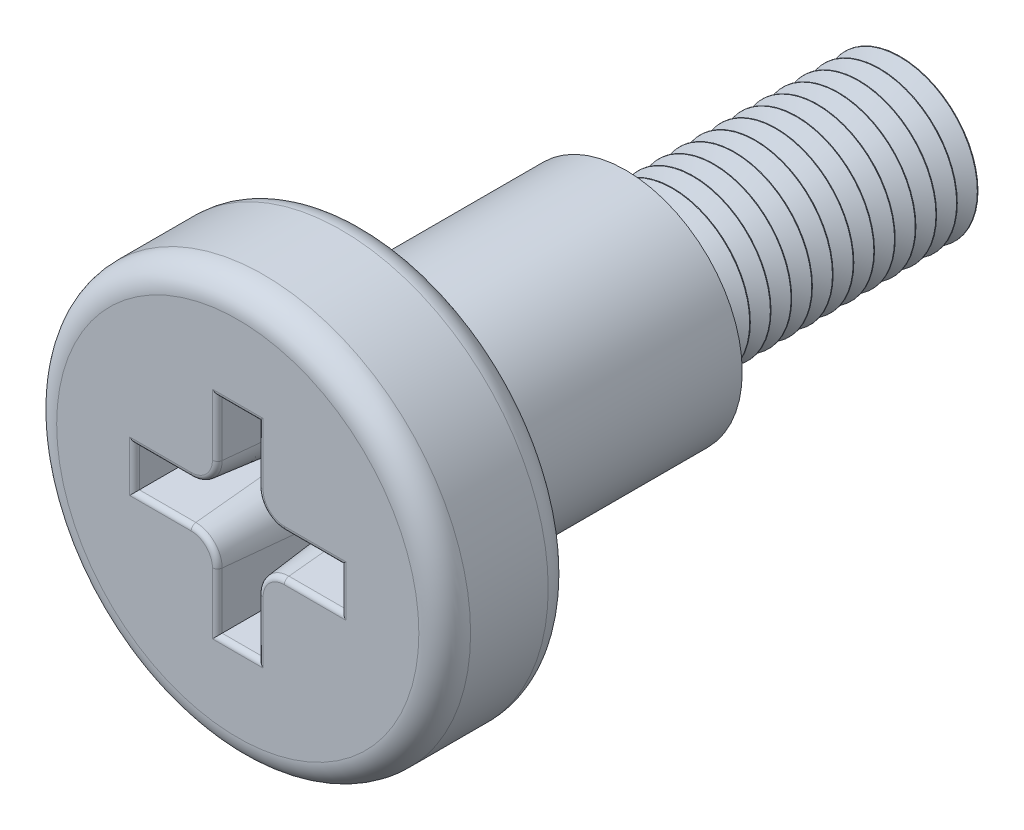
from build123d import *

# Parameters (mm, degrees)
SKETCH1_R           = 4
BOSS_EXTRUDE1_DEPTH = 2.5
FILLET1_R           = 0.5
SKETCH2_R           = 2.25
BOSS_EXTRUDE2_DEPTH = 5
SKETCH3_R           = 1.5
BOSS_EXTRUDE3_DEPTH = 5.5
CUT_EXTRUDE1_DEPTH  = 2
CUT_EXTRUDE1_DRAFT  = -6
FILLET2_R           = 0.1
LPATTERN1_COUNT     = 14
LPATTERN1_PITCH     = 0.4


with BuildPart() as part:
    # Sketch1 → Boss-Extrude1 (new body)
    with BuildSketch(Plane.XY):
        Circle(SKETCH1_R)
    extrude(amount=BOSS_EXTRUDE1_DEPTH)

    # Fillet1
    fillet1_edges = [part.edges().sort_by_distance(p)[0] for p in [
        (-4, 0, 0),
        (-4, 0, 2.5),
    ]]
    fillet(fillet1_edges, radius=FILLET1_R)

    # Sketch2 → Boss-Extrude2 (add)
    with BuildSketch(Plane(origin=(0, 0, 0), x_dir=(-1, 0, 0), z_dir=(0, 0, -1))):
        with Locations(Location((0, 0, 0), (0, 0, 180))):
            Circle(SKETCH2_R)
    extrude(amount=BOSS_EXTRUDE2_DEPTH)

    # Sketch3 → Boss-Extrude3 (add)
    with BuildSketch(Plane(origin=(0, 0, -5), x_dir=(-1, 0, 0), z_dir=(0, 0, -1))):
        Circle(SKETCH3_R)
    extrude(amount=BOSS_EXTRUDE3_DEPTH)


with BuildPart() as cut_extrude1_tool:
    # Sketch4 → Cut-Extrude1 (with draft: the straight prism first)
    with BuildSketch(Plane.XY.offset(2.5)):
        with BuildLine():
            Line((-0.4, -2), (0.4, -2))
            Line((0.4, -2), (0.4, -0.9))
            ThreePointArc((0.4, -0.9), (0.546446609, -0.546446609), (0.9, -0.4))
            Line((0.9, -0.4), (2, -0.4))
            Line((2, -0.4), (2, 0.4))
            Line((2, 0.4), (0.9, 0.4))
            ThreePointArc((0.9, 0.4), (0.546446609, 0.546446609), (0.4, 0.9))
            Line((0.4, 0.9), (0.4, 2))
            Line((0.4, 2), (-0.4, 2))
            Line((-0.4, 2), (-0.4, 0.9))
            ThreePointArc((-0.4, 0.9), (-0.546446609, 0.546446609), (-0.9, 0.4))
            Line((-0.9, 0.4), (-2, 0.4))
            Line((-2, 0.4), (-2, -0.4))
            Line((-2, -0.4), (-0.9, -0.4))
            ThreePointArc((-0.9, -0.4), (-0.546446609, -0.546446609), (-0.4, -0.9))
            Line((-0.4, -0.9), (-0.4, -2))
        make_face()
    extrude(amount=-CUT_EXTRUDE1_DEPTH)
    # Cut-Extrude1: the draft: its side faces are tilted about the plane it starts from
    cut_extrude1_sides = [cut_extrude1_tool.faces().sort_by_distance(p)[0] for p in [
        (-0.4, -1.45, 1.5),
        (0, -2, 1.5),
        (0.4, -1.45, 1.5),
        (0.546446609, -0.546446609, 1.5),
        (1.45, -0.4, 1.5),
        (2, 0, 1.5),
        (1.45, 0.4, 1.5),
        (0.546446609, 0.546446609, 1.5),
        (0.4, 1.45, 1.5),
        (0, 2, 1.5),
        (-0.4, 1.45, 1.5),
        (-0.546446609, 0.546446609, 1.5),
        (-1.45, 0.4, 1.5),
        (-2, 0, 1.5),
        (-1.45, -0.4, 1.5),
        (-0.546446609, -0.546446609, 1.5),
    ]]
    draft(cut_extrude1_sides, Plane.XY.offset(2.5), CUT_EXTRUDE1_DRAFT)


with BuildPart() as part_1:
    add(part.part)

    # Cut-Extrude1: cut by cut_extrude1_tool
    add(cut_extrude1_tool.part, mode=Mode.SUBTRACT)

    # Fillet2
    fillet2_edges = [part_1.edges().sort_by_distance(p)[0] for p in [
        (0.4, 1.45, 2.5),
        (0, 2, 2.5),
        (-0.4, 1.45, 2.5),
        (-0.546446609, 0.546446609, 2.5),
        (-1.45, 0.4, 2.5),
        (-2, 0, 2.5),
        (-1.45, -0.4, 2.5),
        (-0.546446609, -0.546446609, 2.5),
        (-0.4, -1.45, 2.5),
        (0, -2, 2.5),
        (0.4, -1.45, 2.5),
        (0.546446609, -0.546446609, 2.5),
        (1.45, -0.4, 2.5),
        (2, 0, 2.5),
        (1.45, 0.4, 2.5),
        (0.546446609, 0.546446609, 2.5),
    ]]
    fillet(fillet2_edges, radius=FILLET2_R)

    # Sketch5 → Cut-Revolve1 (revolve, cut)
    with BuildSketch(Plane(origin=(0, 0, 0), x_dir=(0, 0, -1), z_dir=(1, 0, 0)), mode=Mode.PRIVATE) as cut_revolve1_sk:
        Polygon((10.5, 1.2), (10.7, 1.51), (10.3, 1.51), align=None)
    cut_revolve1 = revolve(cut_revolve1_sk.sketch.rotate(Axis((0, 0, 3.290536828), (0, 0, -1)), 90), axis=Axis((0, 0, 3.290536828), (0, 0, -1)), mode=Mode.SUBTRACT)

    # LPattern1: Cut-Revolve1 ×14
    with Locations(*[(0, 0, i * LPATTERN1_PITCH) for i in range(1, LPATTERN1_COUNT)]):
        add(cut_revolve1, mode=Mode.SUBTRACT)


solid = part_1.part
